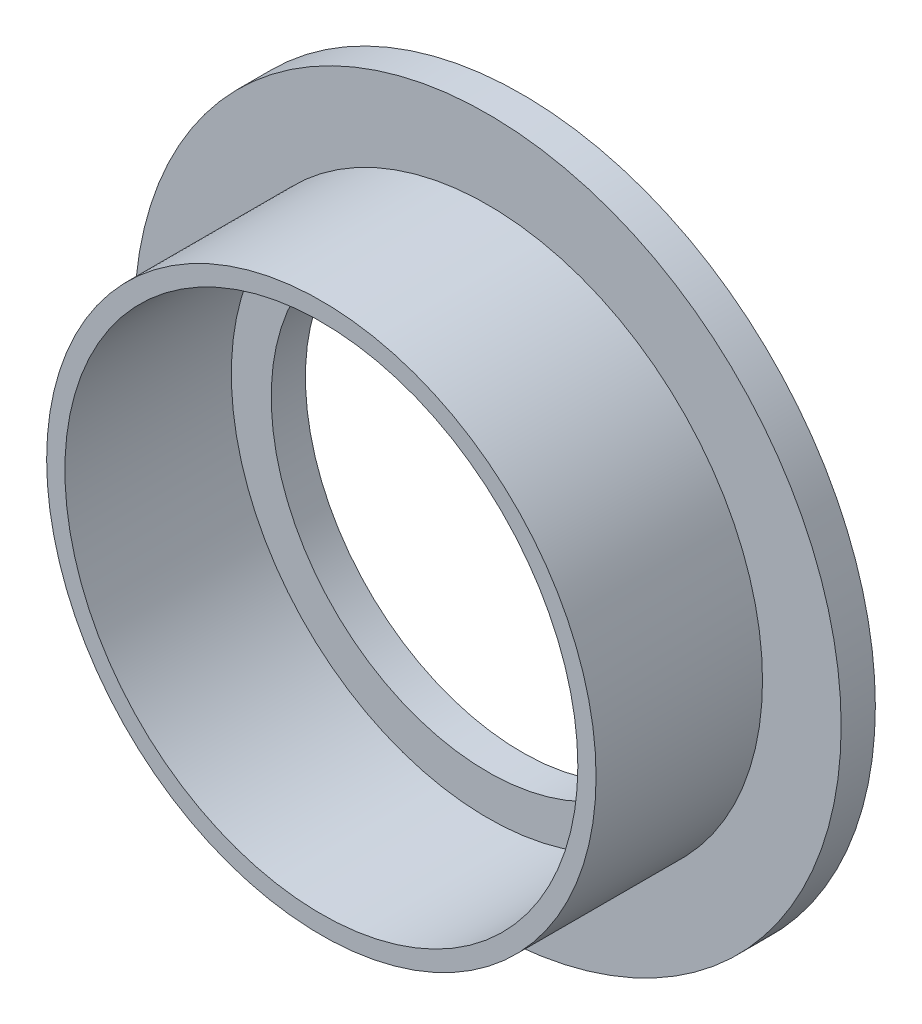
from build123d import *

# Parameters (mm, degrees)
CROQUIS1_R              = 15.5
CROQUIS1_R_2            = 9.5
SALIENTE_EXTRUIR1_DEPTH = 1.5
CROQUIS2_R              = 12.05
CROQUIS2_R_2            = 11.25
SALIENTE_EXTRUIR2_DEPTH = 7.3


with BuildPart() as part:
    # Croquis1 → Saliente-Extruir1 (new body)
    with BuildSketch(Plane.XY):
        Circle(CROQUIS1_R)
        Circle(CROQUIS1_R_2, mode=Mode.SUBTRACT)
    extrude(amount=SALIENTE_EXTRUIR1_DEPTH)

    # Croquis2 → Saliente-Extruir2 (add)
    with BuildSketch(Plane.XY.offset(1.5)):
        Circle(CROQUIS2_R)
        Circle(CROQUIS2_R_2, mode=Mode.SUBTRACT)
    extrude(amount=SALIENTE_EXTRUIR2_DEPTH)


solid = part.part
